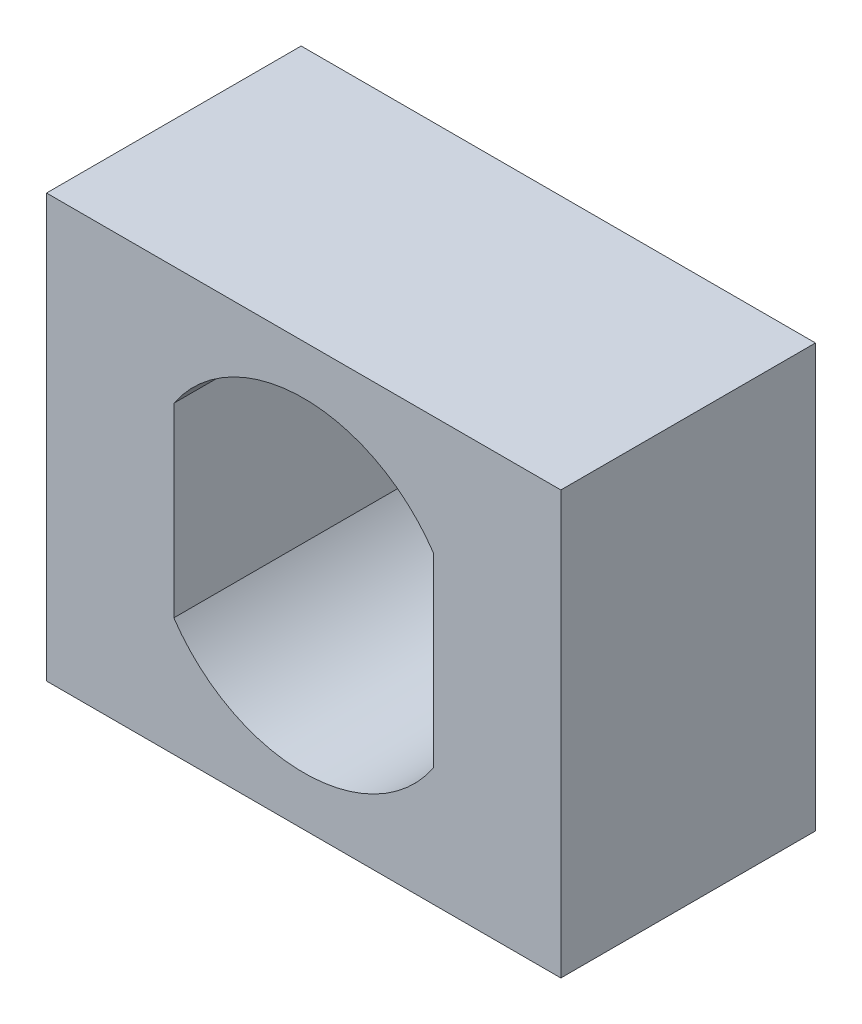
from build123d import *

# Parameters (mm, degrees)
CROQUIS1_W              = 20.2
CROQUIS1_H              = 16.6
SALIENTE_EXTRUIR1_DEPTH = 10
CORTAR_EXTRUIR1_DEPTH   = 10


with BuildPart() as part:
    # Croquis1 → Saliente-Extruir1 (new body)
    with BuildSketch(Plane.XY):
        Rectangle(CROQUIS1_W, CROQUIS1_H)
    extrude(amount=SALIENTE_EXTRUIR1_DEPTH)

    # Croquis2 → Cortar-Extruir1 (cut)
    with BuildSketch(Plane.XY.offset(10)):
        with BuildLine():
            Line((-5.1, -3.65), (-5.1, 3.65))
            ThreePointArc((-5.1, 3.65), (0, 6.37), (5.1, 3.65))
            Line((5.1, 3.65), (5.1, -3.65))
            ThreePointArc((5.1, -3.65), (0, -6.37), (-5.1, -3.65))
        make_face()
    extrude(amount=-CORTAR_EXTRUIR1_DEPTH, mode=Mode.SUBTRACT)


solid = part.part
